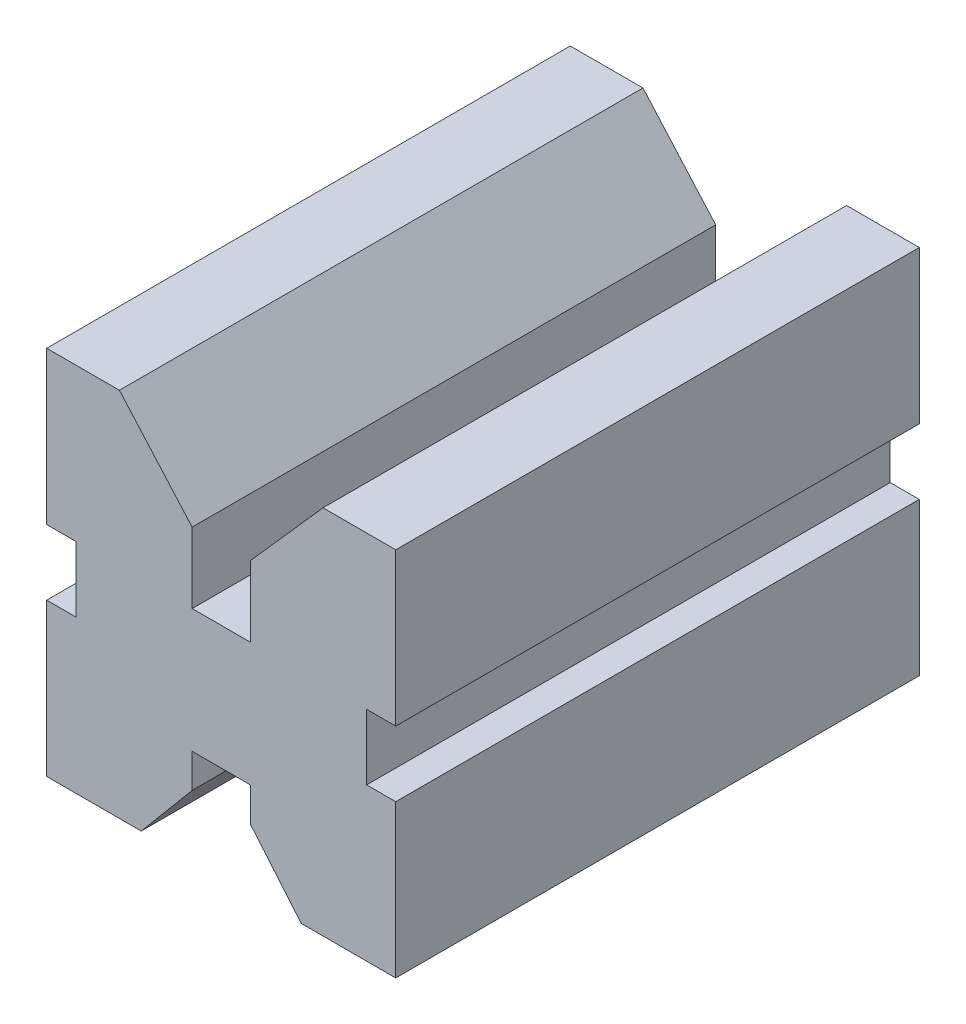
from build123d import *

# Parameters (mm, degrees)
BOSS_EXTRUDE1_DEPTH     = 36
CUT_EXTRUDE1_DEPTH      = 51.222007128
CUT_EXTRUDE1_DEPTH_BACK = 51.222007128
CUT_EXTRUDE2_DEPTH      = 51.222007128
CUT_EXTRUDE2_DEPTH_BACK = 51.222007128


with BuildPart() as part:
    # Sketch1 → Boss-Extrude1 (new, symmetric)
    with BuildSketch(Plane.XY):
        Polygon((-24, -25.5), (-4, -25.5), (-4, -12.5), (4, -12.5), (4, -25.5), (24, -25.5), (24, -4.5), (20, -4.5), (20, 4.5), (24, 4.5), (24, 25.5), (4, 25.5), (4, 4.5), (-4, 4.5), (-4, 25.5), (-24, 25.5), (-24, 4.5), (-20, 4.5), (-20, -4.5), (-24, -4.5), align=None)
    extrude(amount=BOSS_EXTRUDE1_DEPTH, both=True)

    # Sketch2 → Cut-Extrude1 (cut, two sides: drawn at the far end of the back side and taken through both)
    with BuildSketch(Plane.XY.offset(-CUT_EXTRUDE1_DEPTH_BACK)):
        Polygon((-14, 25.5), (-4, 14.197056136), (4, 14.197056136), (14, 25.5), align=None)
    extrude(amount=CUT_EXTRUDE1_DEPTH + CUT_EXTRUDE1_DEPTH_BACK, mode=Mode.SUBTRACT)

    # Sketch3 → Cut-Extrude2 (cut, two sides: drawn at the far end of the back side and taken through both)
    with BuildSketch(Plane.XY.offset(-CUT_EXTRUDE2_DEPTH_BACK)):
        Polygon((4, -17.157724852), (11, -25.5), (-11, -25.5), (-4, -17.157724852), align=None)
    extrude(amount=CUT_EXTRUDE2_DEPTH + CUT_EXTRUDE2_DEPTH_BACK, mode=Mode.SUBTRACT)


solid = part.part
